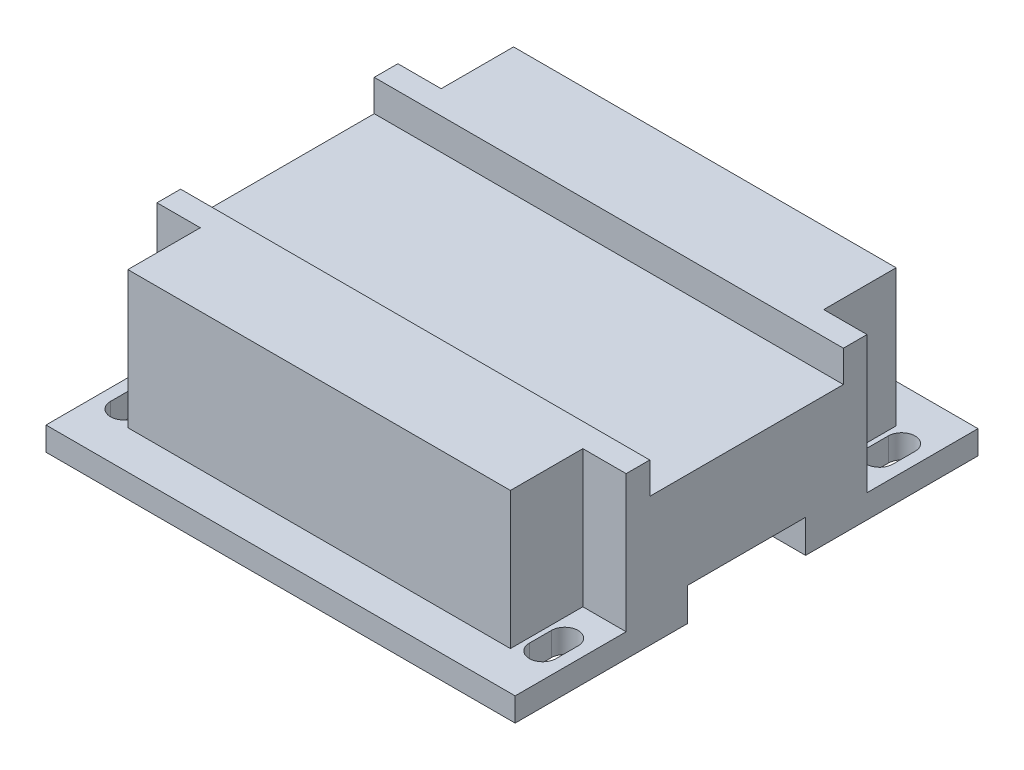
from build123d import *

# Parameters (mm, degrees)
SKETCH1_W           = 75.692
SKETCH1_H           = 62.23
BOSS_EXTRUDE1_DEPTH = 25.908
SKETCH2_W           = 75.692
SKETCH2_H           = 31.242
CUT_EXTRUDE1_DEPTH  = 5.08
SKETCH4_W           = 6.985
SKETCH4_H           = 11.684
CUT_EXTRUDE4_DEPTH  = 22.098
SKETCH3_W           = 75.692
SKETCH3_H           = 19.05
CUT_EXTRUDE5_DEPTH  = 5.334
SKETCH8_W           = 75.692
SKETCH8_H           = 3.81
BOSS_EXTRUDE2_DEPTH = 6.223
SKETCH9_W           = 75.692
SKETCH9_H           = 3.81
BOSS_EXTRUDE3_DEPTH = 6.223
CUT_EXTRUDE6_REACH  = 84.92


with BuildPart() as part:
    # Sketch1 → Boss-Extrude1 (new body)
    with BuildSketch(Plane(origin=(0, 0, 0), x_dir=(1, 0, 0), z_dir=(0, 1, 0))):
        with Locations((-20.973907218, -15.051745981)):
            Rectangle(SKETCH1_W, SKETCH1_H)
    extrude(amount=BOSS_EXTRUDE1_DEPTH)

    # Sketch2 → Cut-Extrude1 (cut)
    with BuildSketch(Plane(origin=(0, 25.908, 0), x_dir=(1, 0, 0), z_dir=(0, 1, 0))):
        with Locations((-20.973907218, -15.051745981)):
            Rectangle(SKETCH2_W, SKETCH2_H)
    extrude(amount=-CUT_EXTRUDE1_DEPTH, mode=Mode.SUBTRACT)

    # Sketch4 → Cut-Extrude4 (cut)
    with BuildSketch(Plane(origin=(0, 25.908, 0), x_dir=(1, 0, 0), z_dir=(0, 1, 0))):
        with Locations((13.379592782, -40.324745981)):
            Rectangle(SKETCH4_W, SKETCH4_H)
        with Locations((-55.327407218, -40.324745981)):
            Rectangle(SKETCH4_W, SKETCH4_H)
        with Locations((-55.327407218, 10.221254019)):
            Rectangle(SKETCH4_W, SKETCH4_H)
        with Locations((13.379592782, 10.221254019)):
            Rectangle(SKETCH4_W, SKETCH4_H)
    extrude(amount=-CUT_EXTRUDE4_DEPTH, mode=Mode.SUBTRACT)

    # Sketch3 → Cut-Extrude5 (cut)
    with BuildSketch(Plane.XZ):
        with Locations((-20.973907218, 15.051745981)):
            Rectangle(SKETCH3_W, SKETCH3_H)
    extrude(amount=-CUT_EXTRUDE5_DEPTH, mode=Mode.SUBTRACT)

    # Sketch8 → Boss-Extrude2 (add)
    with BuildSketch(Plane.XY.offset(46.166745981)):
        with Locations((-20.973907218, 1.905)):
            Rectangle(SKETCH8_W, SKETCH8_H)
    extrude(amount=BOSS_EXTRUDE2_DEPTH)

    # Sketch9 → Boss-Extrude3 (add)
    with BuildSketch(Plane(origin=(0, 0, -16.063254019), x_dir=(-1, 0, 0), z_dir=(0, 0, -1))):
        with Locations((20.973907218, 1.905)):
            Rectangle(SKETCH9_W, SKETCH9_H)
    extrude(amount=BOSS_EXTRUDE3_DEPTH)

    # Sketch7 → Cut-Extrude6 (cut, up to next)
    with BuildSketch(Plane.XZ, mode=Mode.PRIVATE) as cut_extrude6_sk1:
        with BuildLine():
            Line((-56.914907218, 43.880745981), (-56.914907218, 40.324745981))
            ThreePointArc((-56.914907218, 40.324745981), (-54.755907218, 38.165745981), (-52.596907218, 40.324745981))
            Line((-52.596907218, 40.324745981), (-52.596907218, 43.880745981))
            ThreePointArc((-52.596907218, 43.880745981), (-54.755907218, 46.039745981), (-56.914907218, 43.880745981))
        make_face()
    cut_extrude6_tool1 = extrude(cut_extrude6_sk1.sketch, amount=-CUT_EXTRUDE6_REACH, mode=Mode.PRIVATE) & part.part
    # Sketch7 → Cut-Extrude6 (cut, up to next)
    with BuildSketch(Plane.XZ, mode=Mode.PRIVATE) as cut_extrude6_sk2:
        with BuildLine():
            Line((10.649092782, 43.880745981), (10.649092782, 40.324745981))
            ThreePointArc((10.649092782, 40.324745981), (12.808092782, 38.165745981), (14.967092782, 40.324745981))
            Line((14.967092782, 40.324745981), (14.967092782, 43.880745981))
            ThreePointArc((14.967092782, 43.880745981), (12.808092782, 46.039745981), (10.649092782, 43.880745981))
        make_face()
    cut_extrude6_tool2 = extrude(cut_extrude6_sk2.sketch, amount=-CUT_EXTRUDE6_REACH, mode=Mode.PRIVATE) & part.part
    # Sketch7 → Cut-Extrude6 (cut, up to next)
    with BuildSketch(Plane.XZ, mode=Mode.PRIVATE) as cut_extrude6_sk3:
        with BuildLine():
            Line((10.649092782, -10.475254019), (10.649092782, -14.031254019))
            ThreePointArc((10.649092782, -14.031254019), (12.808092782, -16.190254019), (14.967092782, -14.031254019))
            Line((14.967092782, -14.031254019), (14.967092782, -10.475254019))
            ThreePointArc((14.967092782, -10.475254019), (12.808092782, -8.316254019), (10.649092782, -10.475254019))
        make_face()
    cut_extrude6_tool3 = extrude(cut_extrude6_sk3.sketch, amount=-CUT_EXTRUDE6_REACH, mode=Mode.PRIVATE) & part.part
    # Sketch7 → Cut-Extrude6 (cut, up to next)
    with BuildSketch(Plane.XZ, mode=Mode.PRIVATE) as cut_extrude6_sk4:
        with BuildLine():
            Line((-56.914907218, -10.475254019), (-56.914907218, -14.031254019))
            ThreePointArc((-56.914907218, -14.031254019), (-54.755907218, -16.190254019), (-52.596907218, -14.031254019))
            Line((-52.596907218, -14.031254019), (-52.596907218, -10.475254019))
            ThreePointArc((-52.596907218, -10.475254019), (-54.755907218, -8.316254019), (-56.914907218, -10.475254019))
        make_face()
    cut_extrude6_tool4 = extrude(cut_extrude6_sk4.sketch, amount=-CUT_EXTRUDE6_REACH, mode=Mode.PRIVATE) & part.part
    add(cut_extrude6_tool1.solids().sort_by_distance((-54.755907, 0, 42.102746))[0], mode=Mode.SUBTRACT)
    add(cut_extrude6_tool2.solids().sort_by_distance((12.808093, 0, 42.102746))[0], mode=Mode.SUBTRACT)
    add(cut_extrude6_tool3.solids().sort_by_distance((12.808093, 0, -12.253254))[0], mode=Mode.SUBTRACT)
    add(cut_extrude6_tool4.solids().sort_by_distance((-54.755907, 0, -12.253254))[0], mode=Mode.SUBTRACT)


solid = part.part
